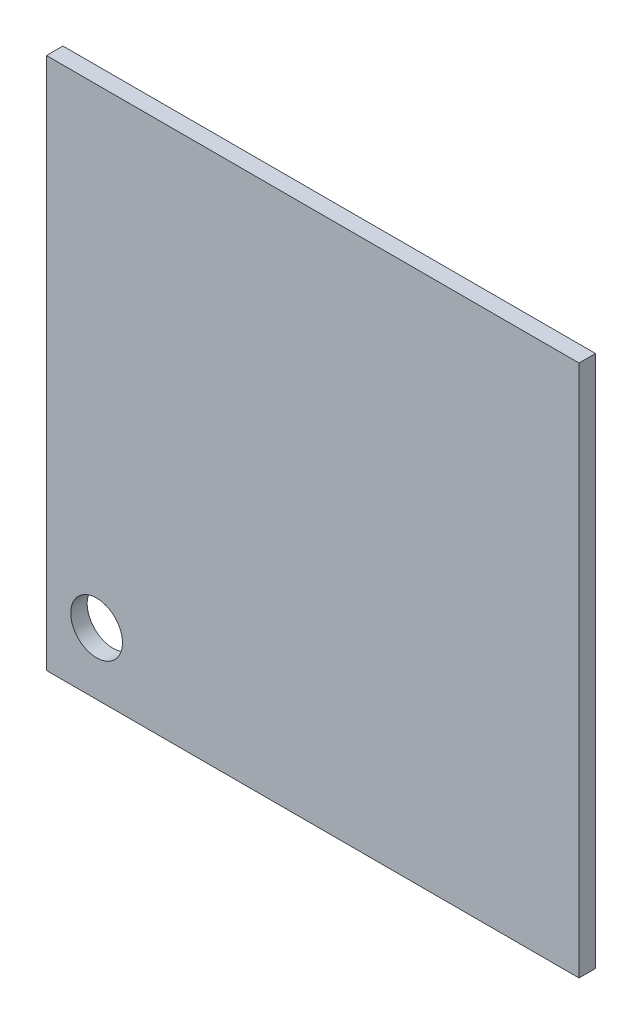
from build123d import *

# Parameters (mm, degrees)
SKETCH1_W           = 97
SKETCH1_H           = 97
BOSS_EXTRUDE1_DEPTH = 3
SKETCH2_R           = 4.714310645
CUT_EXTRUDE1_DEPTH  = 10


with BuildPart() as part:
    # Sketch1 → Boss-Extrude1 (new body)
    with BuildSketch(Plane(origin=(0, 0, 0), x_dir=(0, 1, 0), z_dir=(0, 0, 1))):
        Rectangle(SKETCH1_W, SKETCH1_H)
    extrude(amount=BOSS_EXTRUDE1_DEPTH)

    # Sketch2 → Cut-Extrude1 (cut)
    with BuildSketch(Plane(origin=(0, 0, 3), x_dir=(0, -1, 0), z_dir=(0, 0, 1))):
        with Locations(Location((37.218408128, -39.367729152, 0), (0, 0, 90))):
            Circle(SKETCH2_R)
    extrude(amount=-CUT_EXTRUDE1_DEPTH, mode=Mode.SUBTRACT)


solid = part.part
